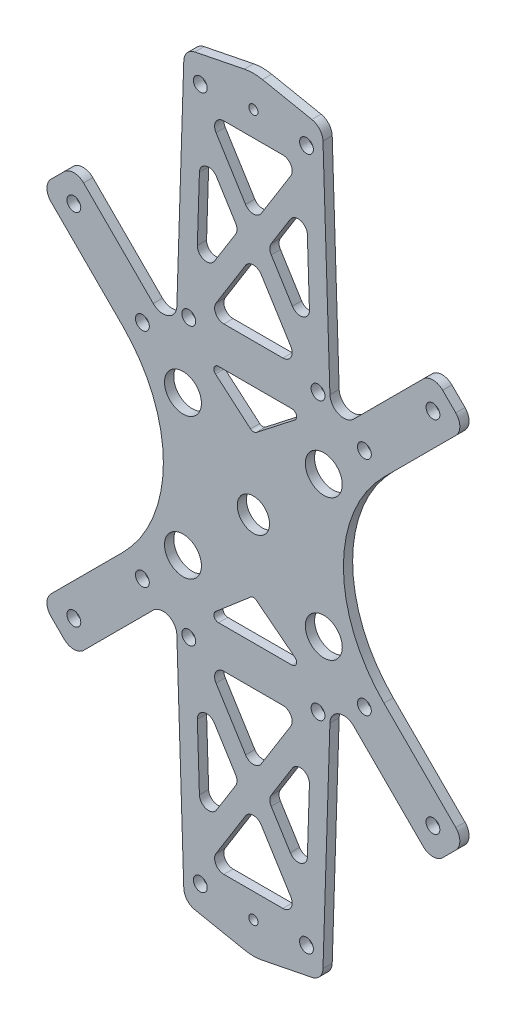
from build123d import *

# Parameters (mm, degrees)
CROQUIS1_R              = 4
CROQUIS1_R_2            = 1.5
CROQUIS1_R_3            = 3.5
CROQUIS1_R_4            = 1
SALIENTE_EXTRUIR1_DEPTH = 2
REDONDEO1_R             = 3
REDONDEO2_R             = 10
REDONDEO3_R             = 2


with BuildPart() as part:
    # Croquis1 → Saliente-Extruir1 (new body)
    with BuildSketch(Plane.XY):
        with BuildLine():
            Line((-42.426406871, 42.426406871), (-38.890872965, 45.961940777))
            Line((-38.890872965, 45.961940777), (-31.096194078, 38.16726189))
            Line((-31.096194078, 38.16726189), (-21.699105276, 28.770173088))
            ThreePointArc((-21.699105276, 28.770173088), (-18.474345963, 28.101794085), (-16.579329074, 30.795251733))
            Line((-16.579329074, 30.795251733), (-15, 80))
            Line((-15, 80), (0, 83))
            Line((0, 83), (15, 80))
            Line((15, 80), (16.579329074, 30.795251733))
            ThreePointArc((16.579329074, 30.795251733), (18.474345963, 28.101794085), (21.699105276, 28.770173088))
            Line((21.699105276, 28.770173088), (31.096194078, 38.16726189))
            Line((31.096194078, 38.16726189), (38.890872965, 45.961940777))
            Line((38.890872965, 45.961940777), (42.426406871, 42.426406871))
            Line((42.426406871, 42.426406871), (45.961940777, 38.890872965))
            Line((45.961940777, 38.890872965), (38.16726189, 31.096194078))
            Line((38.16726189, 31.096194078), (28.284271247, 21.213203436))
            ThreePointArc((28.284271247, 21.213203436), (19.497474683, 0), (28.284271247, -21.213203436))
            Line((28.284271247, -21.213203436), (38.16726189, -31.096194078))
            Line((38.16726189, -31.096194078), (45.961940777, -38.890872965))
            Line((45.961940777, -38.890872965), (42.426406871, -42.426406871))
            Line((42.426406871, -42.426406871), (38.890872965, -45.961940777))
            Line((38.890872965, -45.961940777), (31.096194078, -38.16726189))
            Line((31.096194078, -38.16726189), (21.699105276, -28.770173088))
            ThreePointArc((21.699105276, -28.770173088), (18.474345963, -28.101794085), (16.579329074, -30.795251733))
            Line((16.579329074, -30.795251733), (15, -80))
            Line((15, -80), (0, -83))
            Line((0, -83), (-15, -80))
            Line((-15, -80), (-16.579329074, -30.795251733))
            ThreePointArc((-16.579329074, -30.795251733), (-18.474345963, -28.101794085), (-21.699105276, -28.770173088))
            Line((-21.699105276, -28.770173088), (-31.096194078, -38.16726189))
            Line((-31.096194078, -38.16726189), (-38.890872965, -45.961940777))
            Line((-38.890872965, -45.961940777), (-42.426406871, -42.426406871))
            Line((-42.426406871, -42.426406871), (-45.961940777, -38.890872965))
            Line((-45.961940777, -38.890872965), (-38.16726189, -31.096194078))
            Line((-38.16726189, -31.096194078), (-28.284271247, -21.213203436))
            ThreePointArc((-28.284271247, -21.213203436), (-19.497474683, 0), (-28.284271247, 21.213203436))
            Line((-28.284271247, 21.213203436), (-38.16726189, 31.096194078))
            Line((-38.16726189, 31.096194078), (-45.961940777, 38.890872965))
            Line((-45.961940777, 38.890872965), (-42.426406871, 42.426406871))
        make_face()
        with Locations((-15.25, 15.25)):
            Circle(CROQUIS1_R, mode=Mode.SUBTRACT)
        with Locations((-24.04163056, 24.04163056)):
            Circle(CROQUIS1_R_2, mode=Mode.SUBTRACT)
        with Locations((-38.890872965, 38.890872965)):
            Circle(CROQUIS1_R_2, mode=Mode.SUBTRACT)
        with Locations(Location((38.890872965, 38.890872965, 0), (0, 0, 180))):
            Circle(CROQUIS1_R_2, mode=Mode.SUBTRACT)
        with Locations(Location((24.04163056, 24.04163056, 0), (0, 0, 180))):
            Circle(CROQUIS1_R_2, mode=Mode.SUBTRACT)
        with Locations(Location((15.25, 15.25, 0), (0, 0, 180))):
            Circle(CROQUIS1_R, mode=Mode.SUBTRACT)
        with Locations((15.25, -15.25)):
            Circle(CROQUIS1_R, mode=Mode.SUBTRACT)
        with Locations((24.04163056, -24.04163056)):
            Circle(CROQUIS1_R_2, mode=Mode.SUBTRACT)
        with Locations((38.890872965, -38.890872965)):
            Circle(CROQUIS1_R_2, mode=Mode.SUBTRACT)
        with Locations(Location((-15.25, -15.25, 0), (0, 0, 180))):
            Circle(CROQUIS1_R, mode=Mode.SUBTRACT)
        with Locations(Location((-24.04163056, -24.04163056, 0), (0, 0, 180))):
            Circle(CROQUIS1_R_2, mode=Mode.SUBTRACT)
        with Locations(Location((-38.890872965, -38.890872965, 0), (0, 0, 180))):
            Circle(CROQUIS1_R_2, mode=Mode.SUBTRACT)
        Circle(CROQUIS1_R_3, mode=Mode.SUBTRACT)
        with Locations((-11.5, -75)):
            Circle(CROQUIS1_R_2, mode=Mode.SUBTRACT)
        with Locations(Location((-14, 30, 0), (0, 0, 180))):
            Circle(CROQUIS1_R_2, mode=Mode.SUBTRACT)
        with Locations(Location((11.5, -75, 0), (0, 0, 180))):
            Circle(CROQUIS1_R_2, mode=Mode.SUBTRACT)
        with Locations((11.5, 75)):
            Circle(CROQUIS1_R_2, mode=Mode.SUBTRACT)
        with Locations(Location((-11.5, 75, 0), (0, 0, 180))):
            Circle(CROQUIS1_R_2, mode=Mode.SUBTRACT)
        with Locations((14, 30)):
            Circle(CROQUIS1_R_2, mode=Mode.SUBTRACT)
        with Locations(Location((14, -30, 0), (0, 0, 180))):
            Circle(CROQUIS1_R_2, mode=Mode.SUBTRACT)
        with Locations((-14, -30)):
            Circle(CROQUIS1_R_2, mode=Mode.SUBTRACT)
        with Locations((0, 76)):
            Circle(CROQUIS1_R_4, mode=Mode.SUBTRACT)
        with Locations(Location((0, -76, 0), (0, 0, 180))):
            Circle(CROQUIS1_R_4, mode=Mode.SUBTRACT)
        with BuildLine():
            Line((-0.620989881, -15.781703725), (-8.212878231, -22.282027547))
            ThreePointArc((-8.212878231, -22.282027547), (-8.50046857, -23.388327104), (-7.562491222, -24.04163056))
            Line((-7.562491222, -24.04163056), (8.360661842, -24.04163056))
            ThreePointArc((8.360661842, -24.04163056), (9.30628687, -23.36688939), (8.975807622, -22.253217173))
            Line((8.975807622, -22.253217173), (0.644542909, -15.75289335))
            ThreePointArc((0.644542909, -15.75289335), (0.006637615, -15.541565769), (-0.620989881, -15.781703725))
        make_face(mode=Mode.SUBTRACT)
        with BuildLine():
            Line((-7.562491222, 24.04163056), (8.360661842, 24.04163056))
            ThreePointArc((8.360661842, 24.04163056), (9.30628687, 23.36688939), (8.975807622, 22.253217173))
            Line((8.975807622, 22.253217173), (0.644542909, 15.75289335))
            ThreePointArc((0.644542909, 15.75289335), (0.006637615, 15.541565769), (-0.620989881, 15.781703725))
            Line((-0.620989881, 15.781703725), (-8.212878231, 22.282027547))
            ThreePointArc((-8.212878231, 22.282027547), (-8.50046857, 23.388327104), (-7.562491222, 24.04163056))
        make_face(mode=Mode.SUBTRACT)
        Polygon((-10, -70.668963905), (10, -70.668963905), (0, -54.625), align=None, mode=Mode.SUBTRACT)
        Polygon((0, -48.625), (-10, -32.581036095), (10, -32.581036095), align=None, mode=Mode.SUBTRACT)
        Polygon((-12.377647425, -37.01456174), (-11.479391579, -65.000149753), (-3.206987785, -51.727934965), align=None, mode=Mode.SUBTRACT)
        Polygon((3.206987785, -51.727934965), (11.479391579, -65.000149753), (12.377647425, -37.01456174), align=None, mode=Mode.SUBTRACT)
        Polygon((12.377647425, 37.01456174), (11.479391579, 65.000149753), (3.206987785, 51.727934965), align=None, mode=Mode.SUBTRACT)
        Polygon((-3.206987785, 51.727934965), (-11.479391579, 65.000149753), (-12.377647425, 37.01456174), align=None, mode=Mode.SUBTRACT)
        Polygon((-10, 32.581036095), (10, 32.581036095), (0, 48.625), align=None, mode=Mode.SUBTRACT)
        Polygon((0, 54.625), (-10, 70.668963905), (10, 70.668963905), align=None, mode=Mode.SUBTRACT)
    extrude(amount=SALIENTE_EXTRUIR1_DEPTH)

    # Redondeo1
    redondeo1_edges = [part.edges().sort_by_distance(p)[0] for p in [
        (-38.890872965, 45.961940777, 1),
        (-15, 80, 1),
        (15, 80, 1),
        (38.890872965, 45.961940777, 1),
        (45.961940777, 38.890872965, 1),
        (45.961940777, -38.890872965, 1),
        (38.890872965, -45.961940777, 1),
        (15, -80, 1),
        (-15, -80, 1),
        (-38.890872965, -45.961940777, 1),
        (-45.961940777, -38.890872965, 1),
        (-45.961940777, 38.890872965, 1),
    ]]
    fillet(redondeo1_edges, radius=REDONDEO1_R)

    # Redondeo2
    redondeo2_edges = [part.edges().sort_by_distance(p)[0] for p in [
        (0, 83, 1),
        (0, -83, 1),
    ]]
    fillet(redondeo2_edges, radius=REDONDEO2_R)

    # Redondeo3
    redondeo3_edges = [part.edges().sort_by_distance(p)[0] for p in [
        (0, -54.625, 1),
        (-10, -70.668963905, 1),
        (10, -70.668963905, 1),
        (0, -48.625, 1),
        (10, -32.581036095, 1),
        (-10, -32.581036095, 1),
        (-3.206987785, -51.727934965, 1),
        (-12.377647425, -37.01456174, 1),
        (-11.479391579, -65.000149753, 1),
        (12.377647425, -37.01456174, 1),
        (3.206987785, -51.727934965, 1),
        (11.479391579, -65.000149753, 1),
        (3.206987785, 51.727934965, 1),
        (12.377647425, 37.01456174, 1),
        (11.479391579, 65.000149753, 1),
        (-12.377647425, 37.01456174, 1),
        (-3.206987785, 51.727934965, 1),
        (-11.479391579, 65.000149753, 1),
        (0, 48.625, 1),
        (-10, 32.581036095, 1),
        (10, 32.581036095, 1),
        (0, 54.625, 1),
        (10, 70.668963905, 1),
        (-10, 70.668963905, 1),
    ]]
    fillet(redondeo3_edges, radius=REDONDEO3_R)


solid = part.part
